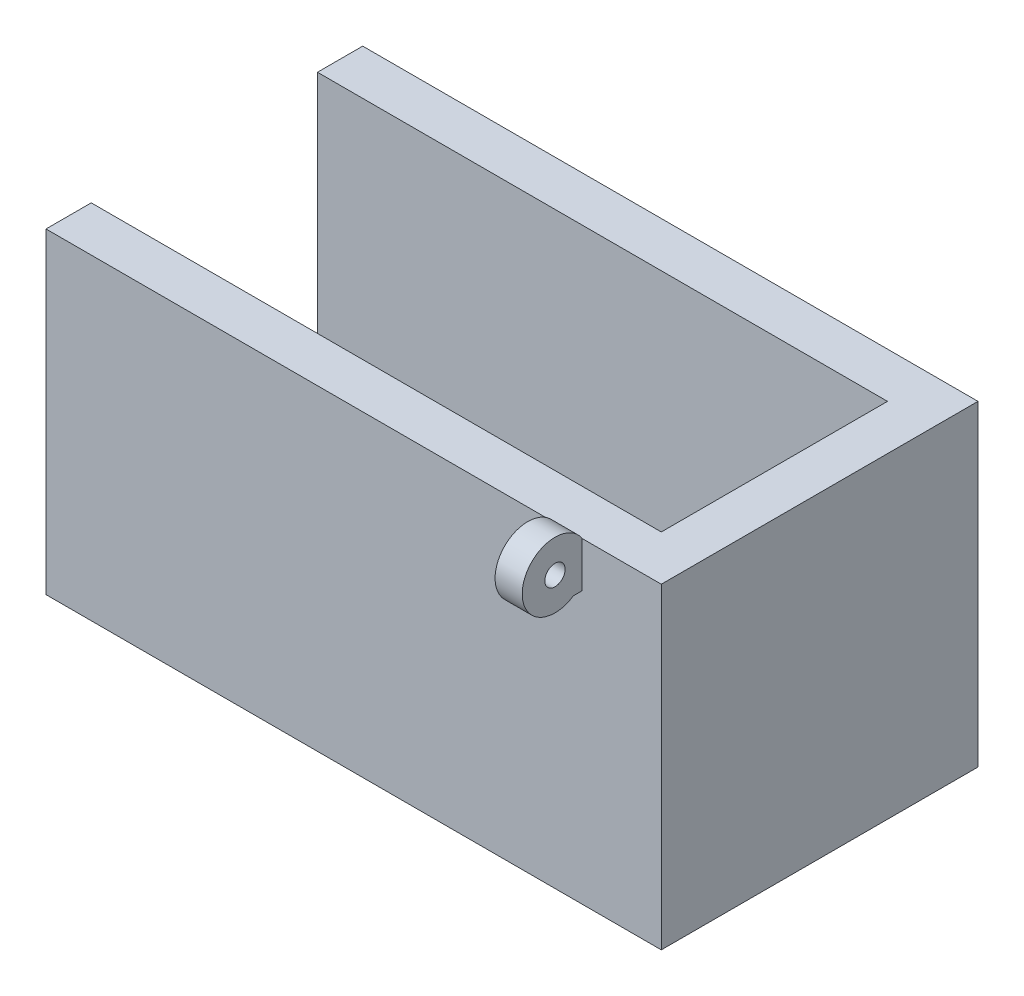
from build123d import *

# Parameters (mm, degrees)
SKETCH_1_W          = 272
SKETCH_1_H          = 140
EXTRUDE_1_DEPTH     = 140
SKETCH_2_W          = 252
SKETCH_2_H          = 100
CUT_EXTRUDE_1_DEPTH = 110
SKETCH_3_W          = 100
SKETCH_3_H          = 13
CUT_EXTRUDE_2_DEPTH = 100
SKETCH_7_R          = 3
CUT_EXTRUDE_3_DEPTH = 211.967749748
SKETCH_8_W          = 12
SKETCH_8_H          = 12
EXTRUDE_2_DEPTH     = 10
SKETCH_9_R          = 14.49
SKETCH_9_R_2        = 4.49
EXTRUDE_1_2_DEPTH   = 12
SKETCH_11_R         = 4.49
CUT_EXTRUDE_5_DEPTH = 298.354040116


with BuildPart() as part:
    # 草圖1 → Extrude 1 (new body)
    with BuildSketch(Plane(origin=(0, 0, 0), x_dir=(1, 0, 0), z_dir=(0, 1, 0))):
        with Locations((26.536585366, -7.390243902)):
            Rectangle(SKETCH_1_W, SKETCH_1_H)
    extrude(amount=EXTRUDE_1_DEPTH)

    # 草圖2 → 除料-伸長1 (cut)
    with BuildSketch(Plane(origin=(0, 140, 0), x_dir=(1, 0, 0), z_dir=(0, 1, 0))):
        with Locations((16.536585366, -7.390243902)):
            Rectangle(SKETCH_2_W, SKETCH_2_H)
    extrude(amount=-CUT_EXTRUDE_1_DEPTH, mode=Mode.SUBTRACT)

    # 草圖3 → 除料-伸長2 (cut)
    with BuildSketch(Plane.ZY.offset(109.463414634)):
        with Locations((7.390243902, 13.5)):
            Rectangle(SKETCH_3_W, SKETCH_3_H)
    extrude(amount=-CUT_EXTRUDE_2_DEPTH, mode=Mode.SUBTRACT)

    # 草圖7 → 除料-伸長3 (cut, through all)
    with BuildSketch(Plane(origin=(0, 30, 0), x_dir=(1, 0, 0), z_dir=(0, 1, 0))):
        with Locations(Location((-89.463414634, -7.390243902, 0), (0, 0, 270))):
            Circle(SKETCH_7_R)
    extrude(amount=-CUT_EXTRUDE_3_DEPTH, mode=Mode.SUBTRACT)

    # 草圖8 → 填料-伸長2 (add)
    with BuildSketch(Plane.XY.offset(77.390243902)):
        with Locations((121.536585366, 126)):
            Rectangle(SKETCH_8_W, SKETCH_8_H)
    extrude(amount=EXTRUDE_2_DEPTH)

    # 草圖9 → Extrude 1 2 (add)
    with BuildSketch(Plane(origin=(127.536585366, 0, 0), x_dir=(0, 0, -1), z_dir=(1, 0, 0))):
        with Locations((-89.390243902, 132)):
            Circle(SKETCH_9_R)
        with Locations((-89.390243902, 132)):
            Circle(SKETCH_9_R_2, mode=Mode.SUBTRACT)
    extrude(amount=-EXTRUDE_1_2_DEPTH)

    # 草圖11 → 除料-伸長5 (cut, through all)
    with BuildSketch(Plane(origin=(127.536585366, 0, 0), x_dir=(0, 0, -1), z_dir=(1, 0, 0))):
        with Locations((-89.390243902, 132)):
            Circle(SKETCH_11_R)
    extrude(amount=-CUT_EXTRUDE_5_DEPTH, mode=Mode.SUBTRACT)


solid = part.part
